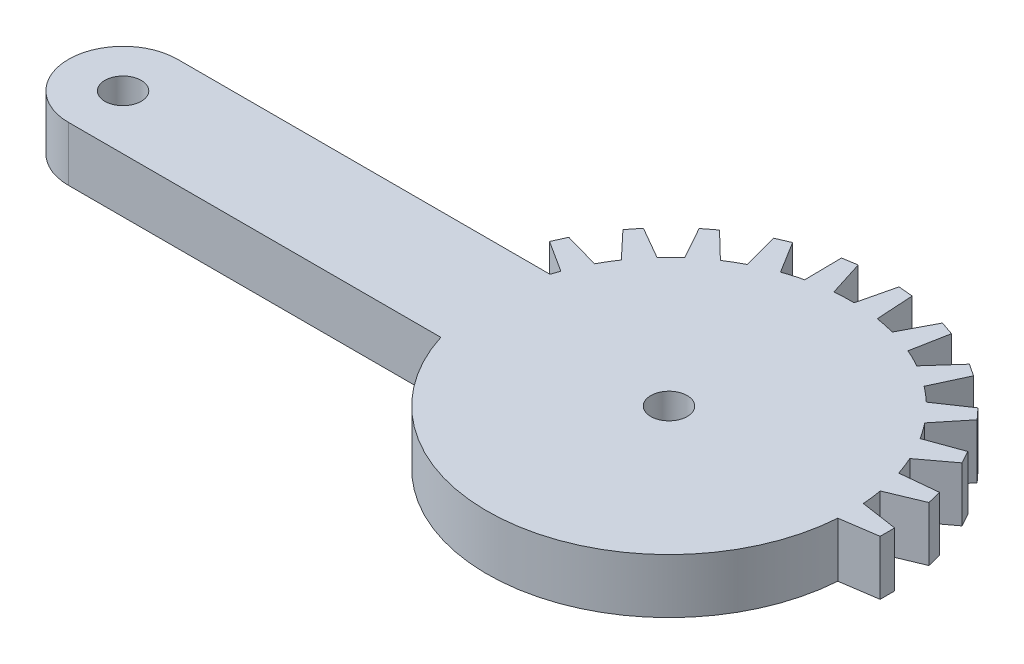
from build123d import *

# Parameters (mm, degrees)
BOSS_EXTRUDE1_DEPTH   = 15
BOSS_EXTRUDE2_DEPTH   = 15
CIRPATTERN2_COUNT     = 13
CIRPATTERN2_ANGLE     = 170
F_1_0MM_DOWEL_HOLE1_D = 10
ESCALA1_SCALE         = 0.2


with BuildPart() as part:
    # Sketch1 → Boss-Extrude1 (new body)
    with BuildSketch(Plane(origin=(0, 0, 0), x_dir=(1, 0, 0), z_dir=(0, 1, 0))):
        with BuildLine():
            Line((-150, 15), (-47.696960071, 15))
            ThreePointArc((-47.696960071, 15), (50, 0), (-47.696960071, -15))
            Line((-47.696960071, -15), (-150, -15))
            ThreePointArc((-150, -15), (-165, 0), (-150, 15))
        make_face()
    extrude(amount=BOSS_EXTRUDE1_DEPTH)

    # Sketch2 → Boss-Extrude2 (add)
    with BuildSketch(Plane(origin=(0, 15, 0), x_dir=(1, 0, 0), z_dir=(0, 1, 0))):
        Polygon((49.877349569, 3.5), (60, 2), (60, -2), (49.877349569, -3.5), (50, 0), align=None)
    boss_extrude2 = extrude(amount=-BOSS_EXTRUDE2_DEPTH)

    # CirPattern2: Boss-Extrude2 ×13 about axis
    cirpattern2_axis = Axis((0, 0, 0), (0, 1, 0))
    for i in range(1, CIRPATTERN2_COUNT):
        add(boss_extrude2.rotate(cirpattern2_axis, i * CIRPATTERN2_ANGLE / (CIRPATTERN2_COUNT - 1)))

    # Ø1.0mm Dowel Hole1 (through all)
    with Locations(Plane(origin=(0, 15, 0), x_dir=(1, 0, 0), z_dir=(0, 1, 0))):
        with Locations((-150, 0), (0, 0)):
            Hole(F_1_0MM_DOWEL_HOLE1_D / 2)


with BuildPart() as part_1:
    # Escala1: scaled about (-28.934441086, 7.5, -2.022629068)
    add(part.part.scale(ESCALA1_SCALE).moved(Location((-23.147552869, 6, -1.618103254))))


solid = part_1.part
